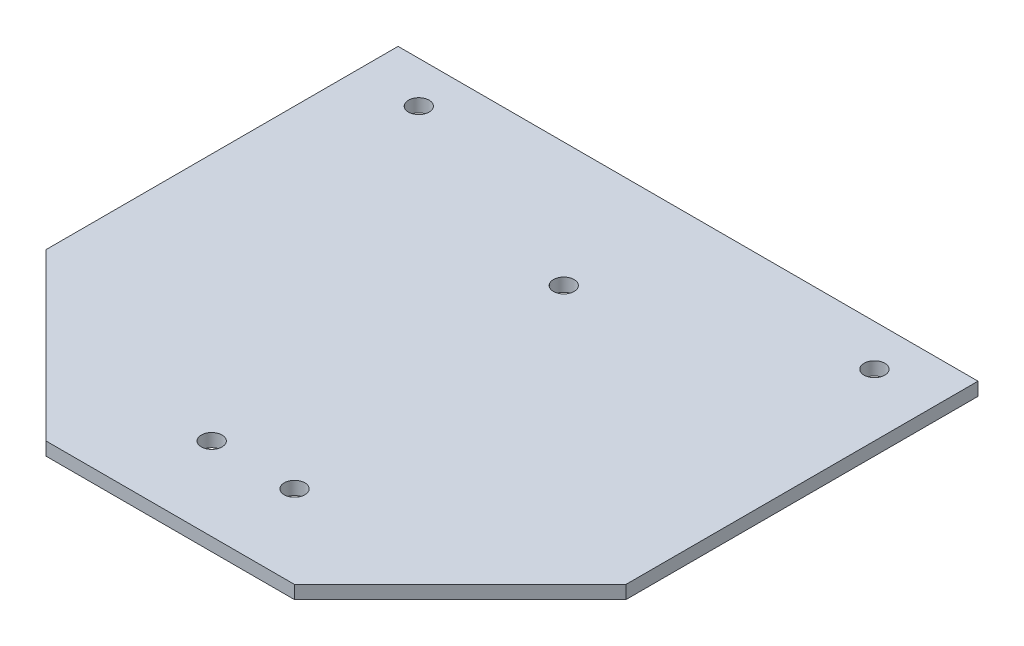
from build123d import *

# Parameters (mm, degrees)
SKETCH1_R           = 2.5
BOSS_EXTRUDE1_DEPTH = 3.18
CUT_EXTRUDE1_DEPTH  = 155.06204075


with BuildPart() as part:
    # Sketch1 → Boss-Extrude1 (new body)
    with BuildSketch(Plane(origin=(0, 0, 0), x_dir=(1, 0, 0), z_dir=(0, 1, 0))):
        Polygon((0, 0), (40, 0), (90, 0), (90, 40), (90, 85), (90, 125), (-50, 125), (-50, 0), align=None)
        with Locations(Location((-35, 115, 0), (0, 0, 90))):
            Circle(SKETCH1_R, mode=Mode.SUBTRACT)
        with Locations(Location((75, 115, 0), (0, 0, 90))):
            Circle(SKETCH1_R, mode=Mode.SUBTRACT)
        with Locations(Location((20, 95, 0), (0, 0, 90))):
            Circle(SKETCH1_R, mode=Mode.SUBTRACT)
        with Locations(Location((10, 20, 0), (0, 0, 90))):
            Circle(SKETCH1_R, mode=Mode.SUBTRACT)
        with Locations(Location((30, 20, 0), (0, 0, 90))):
            Circle(SKETCH1_R, mode=Mode.SUBTRACT)
    extrude(amount=BOSS_EXTRUDE1_DEPTH)

    # Sketch3 → Cut-Extrude1 (cut, through all)
    with BuildSketch(Plane.XZ):
        Polygon((90, -40), (50, 0), (90, 0), align=None)
        Polygon((-50, 0), (-10, 0), (-50, -40), align=None)
    extrude(amount=-CUT_EXTRUDE1_DEPTH, mode=Mode.SUBTRACT)


solid = part.part
